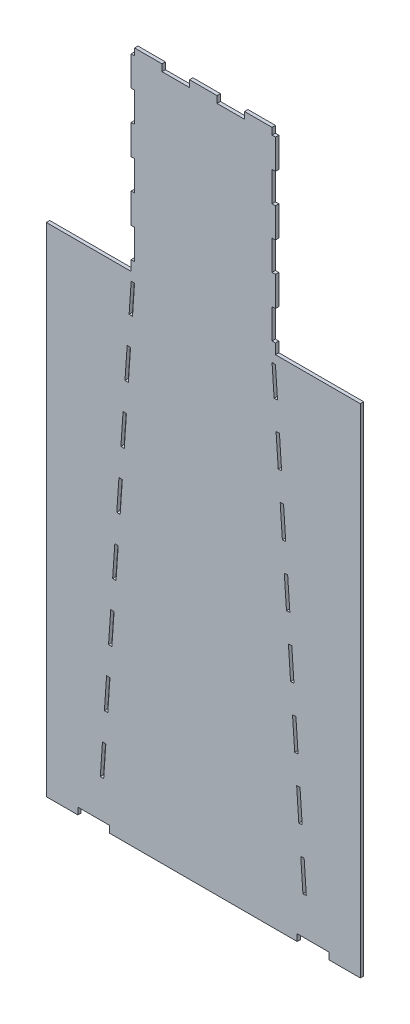
from build123d import *

# Parameters (mm, degrees)
BOSS_EXTRUDE1_DEPTH = 10.16
SKETCH5_W           = 63.5
SKETCH5_H           = 20.32
CUT_EXTRUDE1_DEPTH  = 2126.25967614


with BuildPart() as part:
    # Sketch1 → Boss-Extrude1 (new body)
    with BuildSketch(Plane.XY):
        Polygon((-123.444, 2072.64), (-205.715298803, 2072.64), (-205.715298803, 2052.32), (-215.881789204, 2052.32), (-215.881789204, 1963.42), (-205.715298803, 1963.42), (-205.715298803, 1874.52), (-215.881789204, 1874.52), (-215.881789204, 1785.62), (-205.715298803, 1785.62), (-205.715298803, 1696.72), (-215.875298803, 1696.72), (-215.875298803, 1607.82), (-205.715298803, 1607.82), (-205.715298803, 1518.92), (-215.881789204, 1518.92), (-215.881789204, 1488.440000035), (-469.881789204, 1488.440000035), (-469.881789204, 0), (-375.428294602, 0), (-375.428294602, 20.32), (-280.9748, 20.32), (-280.9748, 0), (280.9748, 0), (280.9748, 20.32), (375.428294602, 20.32), (375.428294602, 0), (469.881789204, 0), (469.881789204, 1488.440000035), (215.881789204, 1488.440000035), (215.881789204, 1518.92), (205.715298803, 1518.92), (205.715298803, 1607.82), (215.875298803, 1607.82), (215.875298803, 1696.72), (205.715298803, 1696.72), (205.715298803, 1785.62), (215.881789204, 1785.62), (215.881789204, 1874.52), (205.715298803, 1874.52), (205.715298803, 1963.42), (215.881789204, 1963.42), (215.881789204, 2052.32), (205.715298803, 2052.32), (205.715298803, 2072.64), (123.444, 2072.64), (123.444, 2052.32), (41.135649402, 2052.32), (41.135649402, 2072.64), (-41.135649402, 2072.64), (-41.135649402, 2052.32), (-123.444, 2052.32), align=None)
        Polygon((215.881789204, 1463.040000035), (222.040744894, 1374.366931824), (211.92306481, 1373.664189215), (205.715298803, 1463.040000035), align=None, mode=Mode.SUBTRACT)
        Polygon((-205.715298803, 1463.040000035), (-211.92306481, 1373.664189215), (-222.040744894, 1374.366931824), (-215.881789204, 1463.040000035), align=None, mode=Mode.SUBTRACT)
        Polygon((240.15668194, 1113.544188093), (246.676567651, 1019.674658983), (236.558887567, 1018.971916374), (230.039001856, 1112.841445484), align=None, mode=Mode.SUBTRACT)
        Polygon((-308.266124544, 132.94397688), (-301.755453134, 226.680843836), (-291.63777305, 225.978101227), (-298.14844446, 132.241234271), align=None, mode=Mode.SUBTRACT)
        Polygon((-289.435698895, 404.053512688), (-279.318018811, 403.350770078), (-285.830533081, 309.587370692), (-295.948213166, 310.290113301), align=None, mode=Mode.SUBTRACT)
        Polygon((-283.630301787, 487.636249721), (-277.115944656, 581.426181539), (-266.998264572, 580.72343893), (-273.512621703, 486.933507112), align=None, mode=Mode.SUBTRACT)
        Polygon((-264.796190418, 758.798850391), (-254.678510334, 758.096107781), (-261.194710324, 664.279643533), (-271.312390408, 664.982386142), align=None, mode=Mode.SUBTRACT)
        Polygon((-252.476436179, 936.171519242), (-242.358756095, 935.468776633), (-248.876798945, 841.625779953), (-258.99447903, 842.328522563), align=None, mode=Mode.SUBTRACT)
        Polygon((301.755453134, 226.680843836), (308.266124544, 132.94397688), (298.14844446, 132.241234271), (291.63777305, 225.978101227), align=None, mode=Mode.SUBTRACT)
        Polygon((279.318018811, 403.350770078), (289.435698895, 404.053512688), (295.948213166, 310.290113301), (285.830533081, 309.587370692), align=None, mode=Mode.SUBTRACT)
        Polygon((277.115944656, 581.426181539), (283.630301787, 487.636249721), (273.512621703, 486.933507112), (266.998264572, 580.72343893), align=None, mode=Mode.SUBTRACT)
        Polygon((254.678510334, 758.096107781), (264.796190418, 758.798850391), (271.312390408, 664.982386142), (261.194710324, 664.279643533), align=None, mode=Mode.SUBTRACT)
        Polygon((242.358756095, 935.468776633), (252.476436179, 936.171519242), (258.99447903, 842.328522563), (248.876798945, 841.625779953), align=None, mode=Mode.SUBTRACT)
        Polygon((-240.15668194, 1113.544188093), (-230.039001856, 1112.841445484), (-236.558887567, 1018.971916374), (-246.676567651, 1019.674658983), align=None, mode=Mode.SUBTRACT)
        Polygon((-227.836927701, 1290.916856945), (-217.719247617, 1290.214114336), (-224.240976188, 1196.318052795), (-234.358656272, 1197.020795404), align=None, mode=Mode.SUBTRACT)
        Polygon((217.719247617, 1290.214114336), (227.836927701, 1290.916856945), (234.358656272, 1197.020795404), (224.240976188, 1196.318052795), align=None, mode=Mode.SUBTRACT)
    extrude(amount=BOSS_EXTRUDE1_DEPTH)

    # Sketch5 → Cut-Extrude1 (cut, through all)
    with BuildSketch(Plane.XY.offset(10.16)):
        with Locations((-501.631789204, 10.16)):
            Rectangle(SKETCH5_W, SKETCH5_H)
        with Locations((501.631789204, 10.16)):
            Rectangle(SKETCH5_W, SKETCH5_H)
    extrude(amount=-CUT_EXTRUDE1_DEPTH, mode=Mode.SUBTRACT)


solid = part.part
